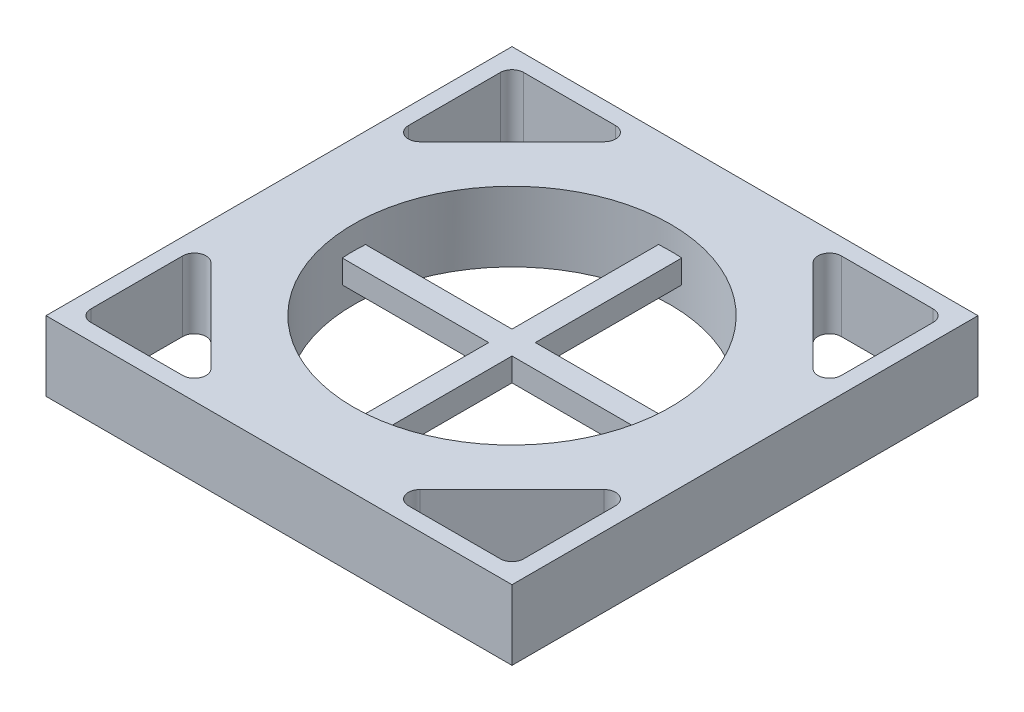
from build123d import *
from build123d.topology import SkipClean

# Parameters (mm, degrees)
SKETCH1_W           = 40
SKETCH1_H           = 40
BOSS_EXTRUDE1_DEPTH = 1
BOSS_EXTRUDE2_START = 2
SKETCH2_W           = 40
SKETCH2_H           = 40
SKETCH2_R           = 13.606270174
BOSS_EXTRUDE2_DEPTH = 2
SKETCH3_W           = 40
SKETCH3_H           = 40
SKETCH3_R           = 13.606270174
BOSS_EXTRUDE3_DEPTH = 2
CUT_EXTRUDE1_DEPTH  = 6


with BuildPart() as part:
    # Sketch1 → Boss-Extrude1 (new, symmetric)
    with BuildSketch(Plane(origin=(0, 0, 0), x_dir=(1, 0, 0), z_dir=(0, 1, 0))):
        Rectangle(SKETCH1_W, SKETCH1_H)
        with BuildLine():
            Line((-1, -1), (-1, -13.569472652))
            ThreePointArc((-1, -13.569472652), (-9.621085907, -9.621085907), (-13.569472652, -1))
            Line((-13.569472652, -1), (-1, -1))
        make_face(mode=Mode.SUBTRACT)
        with BuildLine():
            ThreePointArc((13.569472652, -1), (9.621085907, -9.621085907), (1, -13.569472652))
            Line((1, -13.569472652), (1, -1))
            Line((1, -1), (13.569472652, -1))
        make_face(mode=Mode.SUBTRACT)
        with BuildLine():
            Line((-1, 1), (-13.569472652, 1))
            ThreePointArc((-13.569472652, 1), (-9.621085907, 9.621085907), (-1, 13.569472652))
            Line((-1, 13.569472652), (-1, 1))
        make_face(mode=Mode.SUBTRACT)
        with BuildLine():
            Line((13.569472652, 1), (1, 1))
            Line((1, 1), (1, 13.569472652))
            ThreePointArc((1, 13.569472652), (9.621085907, 9.621085907), (13.569472652, 1))
        make_face(mode=Mode.SUBTRACT)
    extrude(amount=BOSS_EXTRUDE1_DEPTH, both=True)

    # Sketch2 → Boss-Extrude2 (add)
    with BuildSketch(Plane(origin=(0, 1, 0), x_dir=(1, 0, 0), z_dir=(0, 1, 0)).offset(BOSS_EXTRUDE2_START)):
        Rectangle(SKETCH2_W, SKETCH2_H)
        with Locations(Location((0, 0, 0), (0, 0, 85.785216229))):
            Circle(SKETCH2_R, mode=Mode.SUBTRACT)
    extrude(amount=-BOSS_EXTRUDE2_DEPTH)

    # Sketch3 → Boss-Extrude3 (add)
    with SkipClean():  # the faces are left unmerged after this step: merging them gives an invalid solid
        with BuildSketch(Plane.XZ.offset(1)):
            Rectangle(SKETCH3_W, SKETCH3_H)
            with Locations(Location((0, 0, 0), (0, 0, 270))):
                Circle(SKETCH3_R, mode=Mode.SUBTRACT)
        extrude(amount=BOSS_EXTRUDE3_DEPTH)

    # Sketch4 → Cut-Extrude1 (cut)
    with SkipClean():  # the faces are left unmerged after this step: merging them gives an invalid solid
        with BuildSketch(Plane(origin=(0, 3, 0), x_dir=(1, 0, 0), z_dir=(0, 1, 0))):
            with BuildLine():
                Line((-18.578772203, 17.578772203), (-18.578772203, 9.684451785))
                ThreePointArc((-18.578772203, 9.684451785), (-17.961455635, 8.760572252), (-16.871665421, 8.977345004))
                Line((-16.871665421, 8.977345004), (-8.977345004, 16.871665421))
                ThreePointArc((-8.977345004, 16.871665421), (-8.760572252, 17.961455635), (-9.684451785, 18.578772203))
                Line((-9.684451785, 18.578772203), (-17.578772203, 18.578772203))
                ThreePointArc((-17.578772203, 18.578772203), (-18.285878984, 18.285878984), (-18.578772203, 17.578772203))
            make_face()
            with BuildLine():
                Line((8.977345004, 16.871665421), (16.871665421, 8.977345004))
                ThreePointArc((16.871665421, 8.977345004), (17.961455635, 8.760572252), (18.578772203, 9.684451785))
                Line((18.578772203, 9.684451785), (18.578772203, 17.578772203))
                ThreePointArc((18.578772203, 17.578772203), (18.285878984, 18.285878984), (17.578772203, 18.578772203))
                Line((17.578772203, 18.578772203), (9.684451785, 18.578772203))
                ThreePointArc((9.684451785, 18.578772203), (8.760572252, 17.961455635), (8.977345004, 16.871665421))
            make_face()
            with BuildLine():
                Line((16.871665421, -8.977345004), (8.977345004, -16.871665421))
                ThreePointArc((8.977345004, -16.871665421), (8.760572252, -17.961455635), (9.684451785, -18.578772203))
                Line((9.684451785, -18.578772203), (17.578772203, -18.578772203))
                ThreePointArc((17.578772203, -18.578772203), (18.285878984, -18.285878984), (18.578772203, -17.578772203))
                Line((18.578772203, -17.578772203), (18.578772203, -9.684451785))
                ThreePointArc((18.578772203, -9.684451785), (17.961455635, -8.760572252), (16.871665421, -8.977345004))
            make_face()
            with BuildLine():
                Line((-8.977345004, -16.871665421), (-16.871665421, -8.977345004))
                ThreePointArc((-16.871665421, -8.977345004), (-17.961455635, -8.760572252), (-18.578772203, -9.684451785))
                Line((-18.578772203, -9.684451785), (-18.578772203, -17.578772203))
                ThreePointArc((-18.578772203, -17.578772203), (-18.285878984, -18.285878984), (-17.578772203, -18.578772203))
                Line((-17.578772203, -18.578772203), (-9.684451785, -18.578772203))
                ThreePointArc((-9.684451785, -18.578772203), (-8.760572252, -17.961455635), (-8.977345004, -16.871665421))
            make_face()
        extrude(amount=-CUT_EXTRUDE1_DEPTH, mode=Mode.SUBTRACT)


solid = part.part
